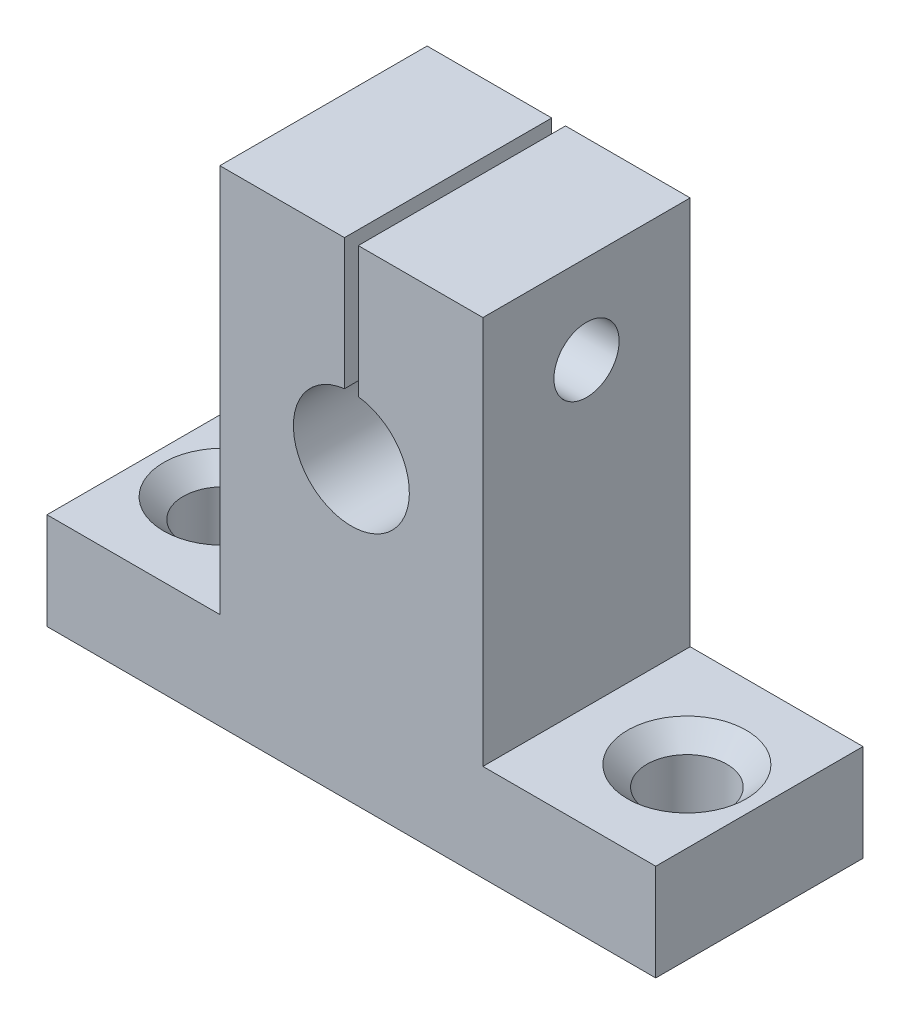
from build123d import *

# Parameters (mm, degrees)
BOSS_EXTRUDE1_DEPTH                                  = 7.15
CBORE_FOR_M4_HEX_SOCKET_HEAD_CAP_SCREW1_D            = 4.5
CBORE_FOR_M4_HEX_SOCKET_HEAD_CAP_SCREW1_CBORE_D      = 8
CBORE_FOR_M4_HEX_SOCKET_HEAD_CAP_SCREW1_CBORE_DEPTH  = 4.4
CSK_FOR_M5_HEX_SOCKET_COUNTERSUNK_CAP_SC_D           = 5.5
CSK_FOR_M5_HEX_SOCKET_COUNTERSUNK_CAP_SC_CSINK_D     = 8.2
CSK_FOR_M5_HEX_SOCKET_COUNTERSUNK_CAP_SC_CSINK_ANGLE = 90


with BuildPart() as part:
    # Sketch2 → Boss-Extrude1 (new, symmetric)
    with BuildSketch(Plane.XY):
        with BuildLine():
            Line((11.925, 6.68), (0, 6.68))
            Line((0, 6.68), (0, 0))
            Line((0, 0), (42, 0))
            Line((42, 0), (42, 6.68))
            Line((42, 6.68), (30.075, 6.68))
            Line((30.075, 6.68), (30.075, 33.5))
            Line((30.075, 33.5), (21.475, 33.5))
            Line((21.475, 33.5), (21.475, 24.471696741))
            ThreePointArc((21.475, 24.471696741), (21, 16.5), (20.525, 24.471696741))
            Line((20.525, 24.471696741), (20.525, 33.5))
            Line((20.525, 33.5), (11.925, 33.5))
            Line((11.925, 33.5), (11.925, 6.68))
        make_face()
    extrude(amount=BOSS_EXTRUDE1_DEPTH, both=True)

    # CBORE for M4 Hex Socket Head Cap Screw1 (through all)
    with Locations(Plane.ZY.offset(-11.925)):
        with Locations((0, 27.4)):
            CounterBoreHole(CBORE_FOR_M4_HEX_SOCKET_HEAD_CAP_SCREW1_D / 2, CBORE_FOR_M4_HEX_SOCKET_HEAD_CAP_SCREW1_CBORE_D / 2, CBORE_FOR_M4_HEX_SOCKET_HEAD_CAP_SCREW1_CBORE_DEPTH)

    # CSK for M5 Hex Socket Countersunk Cap Screw1 (through all)
    with Locations(Plane(origin=(0, 6.68, 0), x_dir=(1, 0, 0), z_dir=(0, 1, 0))):
        with Locations((5, 0), (37, 0)):
            CounterSinkHole(CSK_FOR_M5_HEX_SOCKET_COUNTERSUNK_CAP_SC_D / 2, CSK_FOR_M5_HEX_SOCKET_COUNTERSUNK_CAP_SC_CSINK_D / 2, counter_sink_angle=CSK_FOR_M5_HEX_SOCKET_COUNTERSUNK_CAP_SC_CSINK_ANGLE)


solid = part.part
